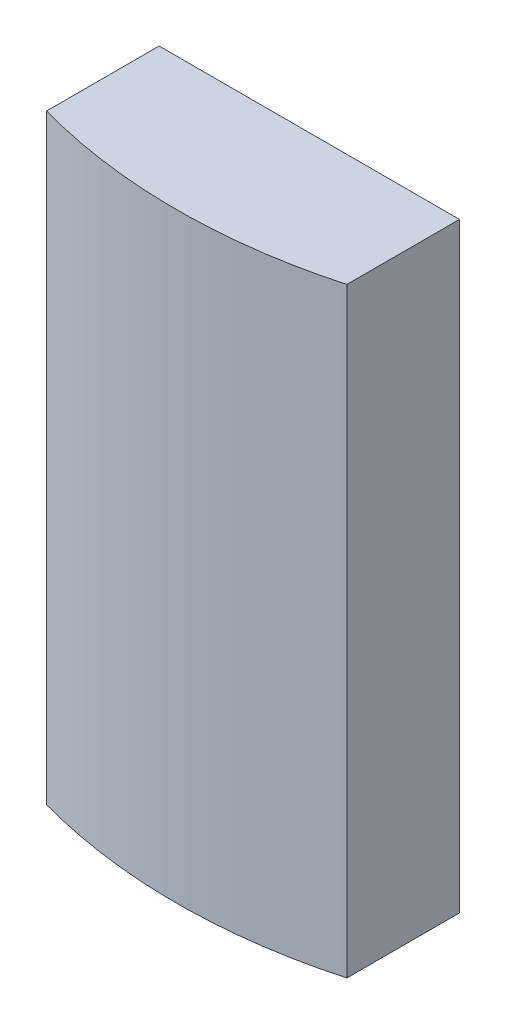
from build123d import *

# Parameters (mm, degrees)
BOSS_EXTRUDE1_DEPTH = 80


with BuildPart() as part:
    # Sketch1 → Boss-Extrude1 (new body)
    with BuildSketch(Plane(origin=(0, 0, 0), x_dir=(1, 0, 0), z_dir=(0, 1, 0))):
        with BuildLine():
            Line((0, 0), (40, 0))
            Line((40, 0), (40, -15))
            ThreePointArc((40, -15), (20, -17.715838526), (0, -15))
            Line((0, -15), (0, 0))
        make_face()
    extrude(amount=BOSS_EXTRUDE1_DEPTH)


solid = part.part
